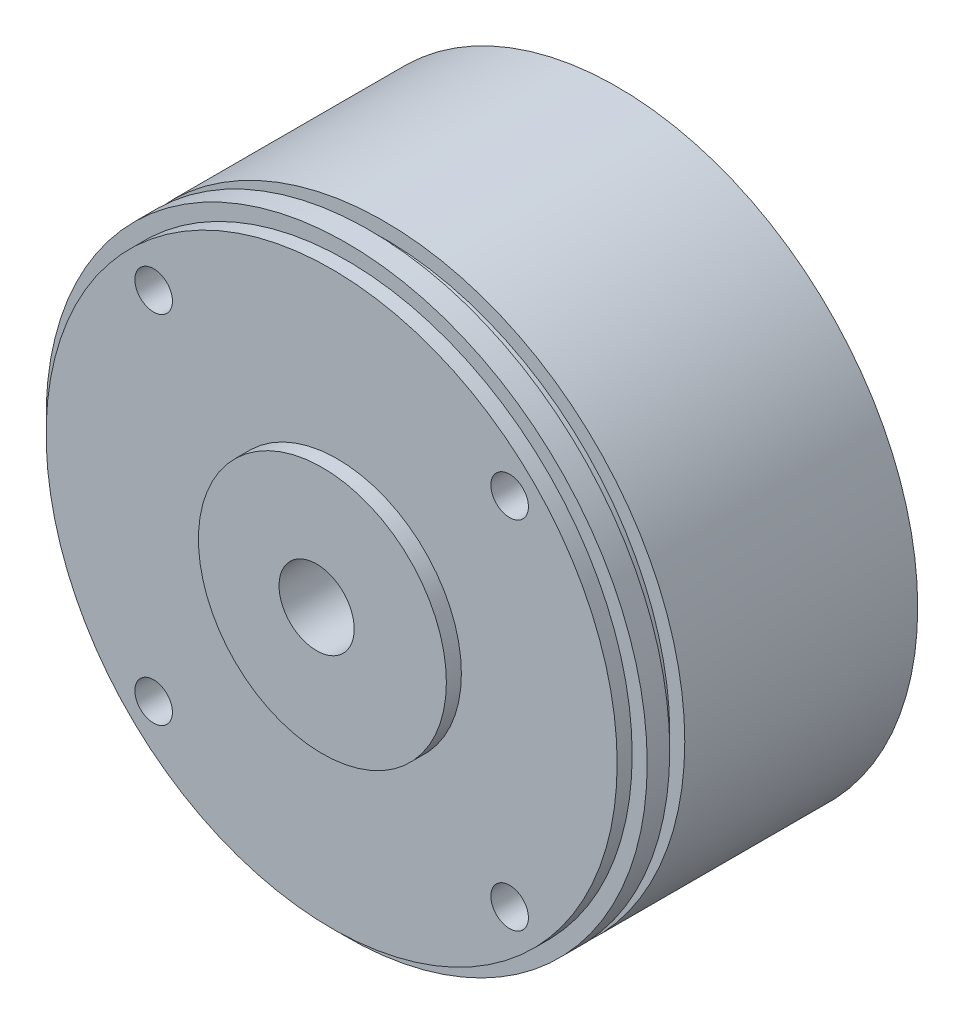
from build123d import *

# Parameters (mm, degrees)
SKETCH_1_R               = 20
EXTRUDE_1_DEPTH          = 20
SKETCH_2_R               = 15
EXTRUDE_2_DEPTH          = 0.5
CUT_EXTRUDE_2_DEPTH      = 4
CUT_EXTRUDE_2_DEPTH_BACK = 4
SKETCH_3_R               = 1.5
CUT_EXTRUDE_START        = -1
SKETCH_4_R               = 20
SKETCH_4_R_2             = 8.25
CUT_EXTRUDE_3_DEPTH      = 1
CUT_EXTRUDE_START_2      = -2
SKETCH_5_R               = 20
SKETCH_5_R_2             = 19
CUT_EXTRUDE_4_DEPTH      = 2
SKETCH_6_R               = 20
SKETCH_6_R_2             = 19
CUT_EXTRUDE_5_DEPTH      = 1
SKETCH_7_R               = 1.25
CUT_EXTRUDE_6_DEPTH      = 5
CUT_EXTRUDE_7_DEPTH      = 5
CUT_EXTRUDE_7_DEPTH_BACK = 35.641016151
SKETCH_8_R               = 6.3
CUT_EXTRUDE_8_DEPTH      = 35.641016151
CUT_EXTRUDE_8_DEPTH_BACK = 35.641016151
SKETCH_9_R               = 2.5


with BuildPart() as part:
    # 草图1 → 凸台-拉伸1 (new body)
    with BuildSketch(Plane.XY):
        Circle(SKETCH_1_R)
    extrude(amount=EXTRUDE_1_DEPTH)

    # 草图2 → 凸台-拉伸2 (add)
    with BuildSketch(Plane.XY):
        Circle(SKETCH_2_R)
    extrude(amount=-EXTRUDE_2_DEPTH)

    # 草图3 → 切除-拉伸2 (cut, two sides: drawn at the far end of the back side and taken through both)
    with BuildSketch(Plane.XY.offset(-CUT_EXTRUDE_2_DEPTH_BACK)):
        with Locations((0, 10)):
            Circle(SKETCH_3_R)
        with Locations((10, 0)):
            Circle(SKETCH_3_R)
        with Locations((0, -10)):
            Circle(SKETCH_3_R)
        with Locations((-10, 0)):
            Circle(SKETCH_3_R)
    extrude(amount=CUT_EXTRUDE_2_DEPTH + CUT_EXTRUDE_2_DEPTH_BACK, mode=Mode.SUBTRACT)

    # 草图4 → 切除-拉伸3 (cut)
    with BuildSketch(Plane.XY.offset(20).offset(CUT_EXTRUDE_START)):
        Circle(SKETCH_4_R)
        with Locations((0.385039993, 0)):
            Circle(SKETCH_4_R_2, mode=Mode.SUBTRACT)
    extrude(amount=CUT_EXTRUDE_3_DEPTH, mode=Mode.SUBTRACT)

    # 草图5 → 切除-拉伸4 (cut)
    with BuildSketch(Plane.XY.offset(20).offset(CUT_EXTRUDE_START_2)):
        Circle(SKETCH_5_R)
        Circle(SKETCH_5_R_2, mode=Mode.SUBTRACT)
    extrude(amount=CUT_EXTRUDE_4_DEPTH, mode=Mode.SUBTRACT)

    # 草图6 → 切除-拉伸5 (cut)
    with BuildSketch(Plane.XY.offset(16.5).offset(CUT_EXTRUDE_START)):
        Circle(SKETCH_6_R)
        Circle(SKETCH_6_R_2, mode=Mode.SUBTRACT)
    extrude(amount=CUT_EXTRUDE_5_DEPTH, mode=Mode.SUBTRACT)

    # 草图7 → 切除-拉伸6 (cut)
    with BuildSketch(Plane.XY.offset(20)):
        with Locations((-11.844038585, -11.844038585)):
            Circle(SKETCH_7_R)
        with Locations((-11.844038585, 11.844038585)):
            Circle(SKETCH_7_R)
        with Locations((11.844038585, 11.844038585)):
            Circle(SKETCH_7_R)
        with Locations((11.844038585, -11.844038585)):
            Circle(SKETCH_7_R)
    extrude(amount=-CUT_EXTRUDE_6_DEPTH, mode=Mode.SUBTRACT)

    # 草图8 → 切除-拉伸7 (cut, two sides: drawn at the far end of the back side and taken through both)
    with BuildSketch(Plane.XY.offset(-CUT_EXTRUDE_7_DEPTH_BACK)):
        Circle(SKETCH_8_R)
    extrude(amount=CUT_EXTRUDE_7_DEPTH + CUT_EXTRUDE_7_DEPTH_BACK, mode=Mode.SUBTRACT)

    # 草图9 → 切除-拉伸8 (cut, two sides: drawn at the far end of the back side and taken through both)
    with BuildSketch(Plane.XY.offset(-CUT_EXTRUDE_8_DEPTH_BACK)):
        Circle(SKETCH_9_R)
    extrude(amount=CUT_EXTRUDE_8_DEPTH + CUT_EXTRUDE_8_DEPTH_BACK, mode=Mode.SUBTRACT)


solid = part.part
